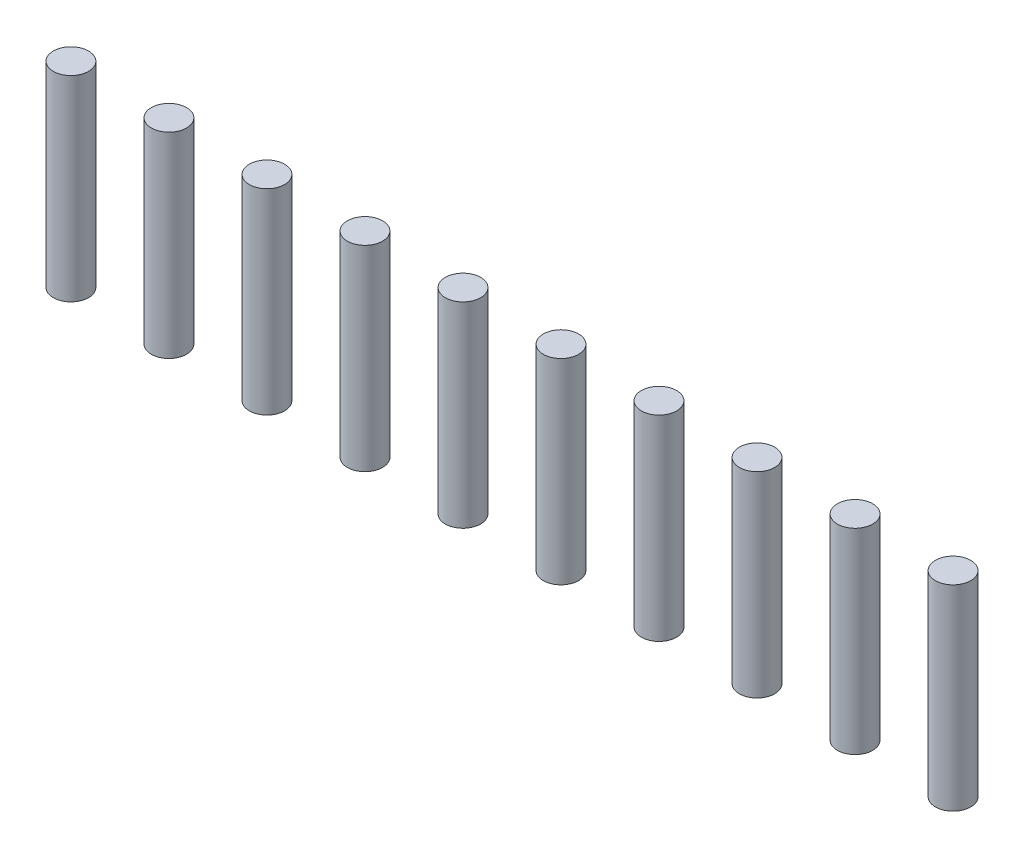
from build123d import *

# Parameters (mm, degrees)
SKETCH_1_R         = 1.8
EXTRUDE_1_DEPTH    = 20
EXTRUDE_1_2_DEPTH  = 20
EXTRUDE_1_3_DEPTH  = 20
EXTRUDE_1_4_DEPTH  = 20
EXTRUDE_1_5_DEPTH  = 20
EXTRUDE_1_6_DEPTH  = 20
EXTRUDE_1_7_DEPTH  = 20
EXTRUDE_1_8_DEPTH  = 20
EXTRUDE_1_9_DEPTH  = 20
EXTRUDE_1_10_DEPTH = 20


with BuildPart() as part:
    # 草图1 → 凸台-拉伸1 (new body)
    with BuildSketch(Plane(origin=(0, 0, 0), x_dir=(1, 0, 0), z_dir=(0, 1, 0))):
        with Locations(Location((0, 0, 0), (0, 0, 270))):
            Circle(SKETCH_1_R)
    extrude(amount=EXTRUDE_1_DEPTH)


with BuildPart() as body_2:
    # 草图1 → Extrude 1 2 (new body)
    with BuildSketch(Plane(origin=(0, 0, 0), x_dir=(1, 0, 0), z_dir=(0, 1, 0))):
        with Locations(Location((10, 0, 0), (0, 0, 270))):
            Circle(SKETCH_1_R)
    extrude(amount=EXTRUDE_1_2_DEPTH)


with BuildPart() as body_3:
    # 草图1 → Extrude 1 3 (new body)
    with BuildSketch(Plane(origin=(0, 0, 0), x_dir=(1, 0, 0), z_dir=(0, 1, 0))):
        with Locations(Location((20, 0, 0), (0, 0, 270))):
            Circle(SKETCH_1_R)
    extrude(amount=EXTRUDE_1_3_DEPTH)


with BuildPart() as body_4:
    # 草图1 → Extrude 1 4 (new body)
    with BuildSketch(Plane(origin=(0, 0, 0), x_dir=(1, 0, 0), z_dir=(0, 1, 0))):
        with Locations(Location((30, 0, 0), (0, 0, 270))):
            Circle(SKETCH_1_R)
    extrude(amount=EXTRUDE_1_4_DEPTH)


with BuildPart() as body_5:
    # 草图1 → Extrude 1 5 (new body)
    with BuildSketch(Plane(origin=(0, 0, 0), x_dir=(1, 0, 0), z_dir=(0, 1, 0))):
        with Locations(Location((40, 0, 0), (0, 0, 270))):
            Circle(SKETCH_1_R)
    extrude(amount=EXTRUDE_1_5_DEPTH)


with BuildPart() as body_6:
    # 草图1 → Extrude 1 6 (new body)
    with BuildSketch(Plane(origin=(0, 0, 0), x_dir=(1, 0, 0), z_dir=(0, 1, 0))):
        with Locations(Location((50, 0, 0), (0, 0, 270))):
            Circle(SKETCH_1_R)
    extrude(amount=EXTRUDE_1_6_DEPTH)


with BuildPart() as body_7:
    # 草图1 → Extrude 1 7 (new body)
    with BuildSketch(Plane(origin=(0, 0, 0), x_dir=(1, 0, 0), z_dir=(0, 1, 0))):
        with Locations(Location((60, 0, 0), (0, 0, 270))):
            Circle(SKETCH_1_R)
    extrude(amount=EXTRUDE_1_7_DEPTH)


with BuildPart() as body_8:
    # 草图1 → Extrude 1 8 (new body)
    with BuildSketch(Plane(origin=(0, 0, 0), x_dir=(1, 0, 0), z_dir=(0, 1, 0))):
        with Locations(Location((70, 0, 0), (0, 0, 270))):
            Circle(SKETCH_1_R)
    extrude(amount=EXTRUDE_1_8_DEPTH)


with BuildPart() as body_9:
    # 草图1 → Extrude 1 9 (new body)
    with BuildSketch(Plane(origin=(0, 0, 0), x_dir=(1, 0, 0), z_dir=(0, 1, 0))):
        with Locations(Location((80, 0, 0), (0, 0, 270))):
            Circle(SKETCH_1_R)
    extrude(amount=EXTRUDE_1_9_DEPTH)


with BuildPart() as body_10:
    # 草图1 → Extrude 1 10 (new body)
    with BuildSketch(Plane(origin=(0, 0, 0), x_dir=(1, 0, 0), z_dir=(0, 1, 0))):
        with Locations(Location((90, 0, 0), (0, 0, 270))):
            Circle(SKETCH_1_R)
    extrude(amount=EXTRUDE_1_10_DEPTH)


solid = Compound([part.part, body_2.part, body_3.part, body_4.part, body_5.part, body_6.part, body_7.part, body_8.part, body_9.part, body_10.part])
